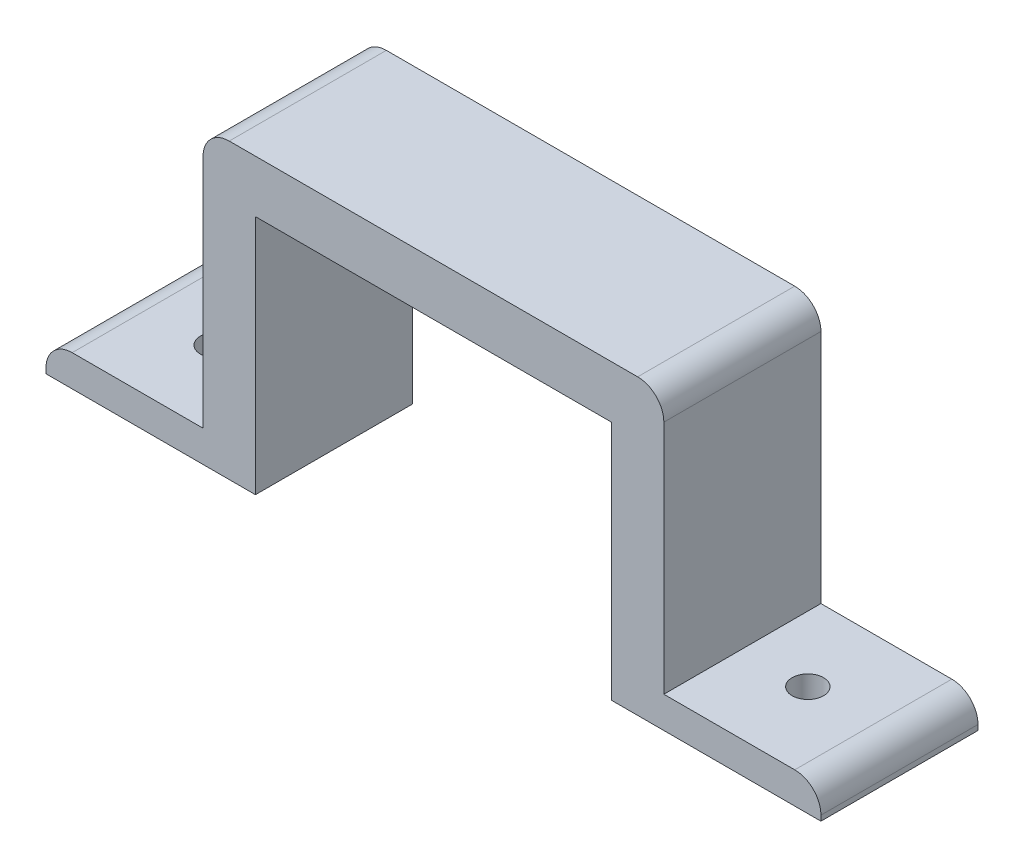
from build123d import *

# Parameters (mm, degrees)
BOSS_EXTRUDE1_DEPTH = 15
FILLET1_R           = 2.5
SKETCH2_R           = 1.5
CUT_EXTRUDE1_DEPTH  = 3


with BuildPart() as part:
    # Sketch1 → Boss-Extrude1 (new body)
    with BuildSketch(Plane.XY):
        Polygon((17, 23), (-17, 23), (-17, 0), (-37, 0), (-37, 3), (-22, 3), (-22, 28), (22, 28), (22, 3), (37, 3), (37, 0), (17, 0), align=None)
    extrude(amount=BOSS_EXTRUDE1_DEPTH)

    # Fillet1
    fillet1_edges = [part.edges().sort_by_distance(p)[0] for p in [
        (-37, 3, 7.5),
        (-22, 28, 7.5),
        (22, 28, 7.5),
        (37, 3, 7.5),
    ]]
    fillet(fillet1_edges, radius=FILLET1_R)

    # Sketch2 → Cut-Extrude1 (cut)
    with BuildSketch(Plane(origin=(0, 3, 0), x_dir=(1, 0, 0), z_dir=(0, 1, 0))):
        with Locations(Location((-28.25, -7.5, 0), (0, 0, 270))):
            Circle(SKETCH2_R)
        with Locations(Location((28.25, -7.5, 0), (0, 0, 270))):
            Circle(SKETCH2_R)
    extrude(amount=-CUT_EXTRUDE1_DEPTH, mode=Mode.SUBTRACT)


solid = part.part
